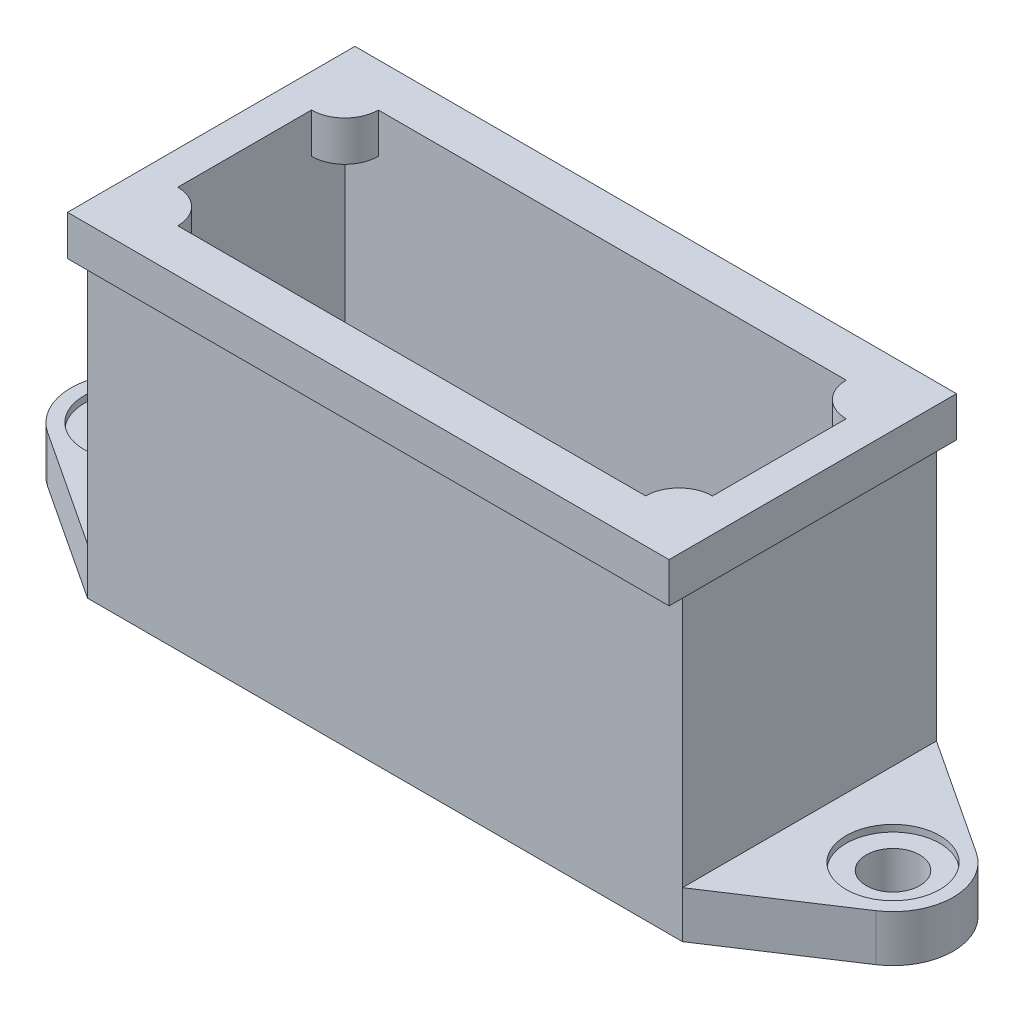
from build123d import *

# Parameters (mm, degrees)
SKETCH1_W                                = 178
SKETCH1_H                                = 76
BOSS_EXTRUDE1_DEPTH                      = 90
BOSS_EXTRUDE2_DEPTH                      = 14
CBORE_FOR_M14_HEX_HEAD_BOLT1_D           = 16
CBORE_FOR_M14_HEX_HEAD_BOLT1_CBORE_D     = 28
CBORE_FOR_M14_HEX_HEAD_BOLT1_CBORE_DEPTH = 2
SKETCH4_W                                = 160
SKETCH4_H                                = 60
CUT_EXTRUDE1_DEPTH                       = 63
SKETCH5_W                                = 180
SKETCH5_H                                = 86
SKETCH5_W_2                              = 178
SKETCH5_H_2                              = 76
BOSS_EXTRUDE4_DEPTH                      = 12


with BuildPart() as part:
    # Sketch1 → Boss-Extrude1 (new body)
    with BuildSketch(Plane(origin=(0, 0, 0), x_dir=(1, 0, 0), z_dir=(0, 1, 0))):
        Rectangle(SKETCH1_W, SKETCH1_H)
    extrude(amount=BOSS_EXTRUDE1_DEPTH)

    # Sketch2 → Boss-Extrude2 (add)
    with BuildSketch(Plane(origin=(0, 0, 0), x_dir=(1, 0, 0), z_dir=(0, 1, 0))):
        with BuildLine():
            Line((123.89505406, 15.036219776), (89, 38))
            Line((89, 38), (89, -38))
            Line((89, -38), (123.89505406, -15.036219776))
            ThreePointArc((123.89505406, -15.036219776), (132, 0), (123.89505406, 15.036219776))
        make_face()
    boss_extrude2 = extrude(amount=BOSS_EXTRUDE2_DEPTH)

    # CBORE for M14 Hex Head Bolt1 (through all)
    with Locations(Plane(origin=(114, 14, 0), x_dir=(0, 0, 1), z_dir=(0, 1, 0))):
        with Locations((0, 0)):
            cbore_for_m14_hex_head_bolt1 = CounterBoreHole(CBORE_FOR_M14_HEX_HEAD_BOLT1_D / 2, CBORE_FOR_M14_HEX_HEAD_BOLT1_CBORE_D / 2, CBORE_FOR_M14_HEX_HEAD_BOLT1_CBORE_DEPTH)

    # Mirror1: Boss-Extrude2, CBORE for M14 Hex Head Bolt1 across plane
    add(boss_extrude2.mirror(Plane(origin=(0, 0, 0), x_dir=(0, 0, 1), z_dir=(1, 0, 0))))
    add(cbore_for_m14_hex_head_bolt1.mirror(Plane(origin=(0, 0, 0), x_dir=(0, 0, 1), z_dir=(1, 0, 0))), mode=Mode.SUBTRACT)

    # Sketch4 → Cut-Extrude1 (cut)
    with BuildSketch(Plane(origin=(0, 90, 0), x_dir=(1, 0, 0), z_dir=(0, 1, 0))):
        Rectangle(SKETCH4_W, SKETCH4_H)
    extrude(amount=-CUT_EXTRUDE1_DEPTH, mode=Mode.SUBTRACT)

    # Sketch5 → Boss-Extrude4 (add)
    # profile 1 of 6: a face of its own
    with BuildSketch(Plane(origin=(0, 90, 0), x_dir=(1, 0, 0), z_dir=(0, 1, 0))):
        Rectangle(SKETCH5_W, SKETCH5_H)
        Rectangle(SKETCH5_W_2, SKETCH5_H_2, mode=Mode.SUBTRACT)
    # profile 2 of 6: a face of its own
    with BuildSketch(Plane(origin=(0, 90, 0), x_dir=(1, 0, 0), z_dir=(0, 1, 0))):
        Rectangle(SKETCH5_W_2, SKETCH5_H_2)
        Polygon((70, -30), (-70, -30), (-80, -30), (-80, -20), (-80, 20), (-80, 30), (-70, 30), (70, 30), (80, 30), (80, 20), (80, -20), (80, -30), align=None, mode=Mode.SUBTRACT)
    # profile 3 of 6: a face of its own
    with BuildSketch(Plane(origin=(0, 90, 0), x_dir=(1, 0, 0), z_dir=(0, 1, 0))):
        with BuildLine():
            Line((-80, 30), (-80, 20))
            ThreePointArc((-80, 20), (-72.928932188, 22.928932188), (-70, 30))
            Line((-70, 30), (-80, 30))
        make_face()
    # profile 4 of 6: a face of its own
    with BuildSketch(Plane(origin=(0, 90, 0), x_dir=(1, 0, 0), z_dir=(0, 1, 0))):
        with BuildLine():
            Line((-80, -30), (-70, -30))
            ThreePointArc((-70, -30), (-72.928932188, -22.928932188), (-80, -20))
            Line((-80, -20), (-80, -30))
        make_face()
    # profile 5 of 6: a face of its own
    with BuildSketch(Plane(origin=(0, 90, 0), x_dir=(1, 0, 0), z_dir=(0, 1, 0))):
        with BuildLine():
            ThreePointArc((80, -20), (72.928932188, -22.928932188), (70, -30))
            Line((70, -30), (80, -30))
            Line((80, -30), (80, -20))
        make_face()
    # profile 6 of 6: a face of its own
    with BuildSketch(Plane(origin=(0, 90, 0), x_dir=(1, 0, 0), z_dir=(0, 1, 0))):
        with BuildLine():
            ThreePointArc((70, 30), (72.928932188, 22.928932188), (80, 20))
            Line((80, 20), (80, 30))
            Line((80, 30), (70, 30))
        make_face()
    extrude(amount=BOSS_EXTRUDE4_DEPTH)


solid = part.part
